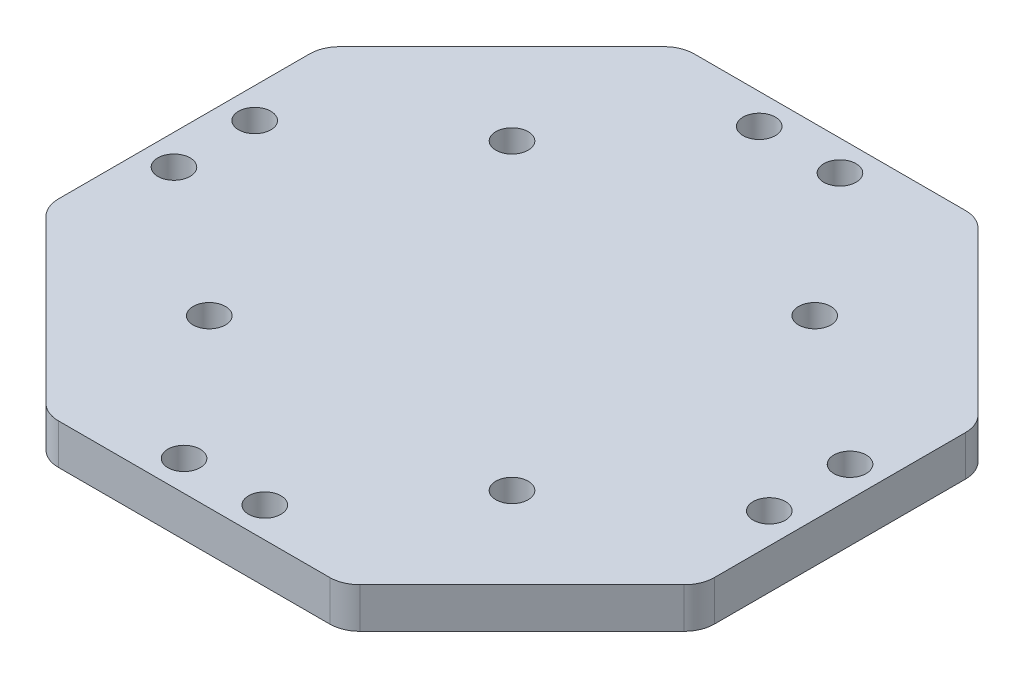
from build123d import *

# Parameters (mm, degrees)
SKETCH_1_W          = 65
SKETCH_1_H          = 63
EXTRUDE_1_DEPTH     = 4
SKETCH_2_R          = 1.6
CUT_EXTRUDE_1_DEPTH = 4
SKETCH_3_R          = 1.6
CUT_EXTRUDE_2_DEPTH = 4
FILLET_1_R          = 3
CUT_EXTRUDE_3_DEPTH = 10
FILLET_2_R          = 3


with BuildPart() as part:
    # 草图1 → 凸台-拉伸1 (new body)
    with BuildSketch(Plane(origin=(0, 0, 0), x_dir=(1, 0, 0), z_dir=(0, 1, 0))):
        Rectangle(SKETCH_1_W, SKETCH_1_H)
    extrude(amount=EXTRUDE_1_DEPTH)

    # 草图2 → 切除-拉伸1 (cut)
    with BuildSketch(Plane(origin=(0, 4, 0), x_dir=(1, 0, 0), z_dir=(0, 1, 0))):
        with Locations(Location((-15, -15, 0), (0, 0, 270))):
            Circle(SKETCH_2_R)
        with Locations(Location((-15, 15, 0), (0, 0, 90))):
            Circle(SKETCH_2_R)
        with Locations(Location((15, 15, 0), (0, 0, 270))):
            Circle(SKETCH_2_R)
        with Locations(Location((15, -15, 0), (0, 0, 90))):
            Circle(SKETCH_2_R)
    extrude(amount=-CUT_EXTRUDE_1_DEPTH, mode=Mode.SUBTRACT)

    # 草图3 → 切除-拉伸2 (cut)
    with BuildSketch(Plane(origin=(0, 4, 0), x_dir=(1, 0, 0), z_dir=(0, 1, 0))):
        with Locations(Location((-4, -28.5, 0), (0, 0, 270))):
            Circle(SKETCH_3_R)
        with Locations(Location((4, -28.5, 0), (0, 0, 90))):
            Circle(SKETCH_3_R)
        with Locations(Location((4, 28.5, 0), (0, 0, 270))):
            Circle(SKETCH_3_R)
        with Locations(Location((-4, 28.5, 0), (0, 0, 90))):
            Circle(SKETCH_3_R)
        with Locations(Location((-29.5, -4, 0), (0, 0, 270))):
            Circle(SKETCH_3_R)
        with Locations(Location((-29.5, 4, 0), (0, 0, 90))):
            Circle(SKETCH_3_R)
        with Locations(Location((29.5, 4, 0), (0, 0, 270))):
            Circle(SKETCH_3_R)
        with Locations(Location((29.5, -4, 0), (0, 0, 90))):
            Circle(SKETCH_3_R)
    extrude(amount=-CUT_EXTRUDE_2_DEPTH, mode=Mode.SUBTRACT)

    # 圆角1
    fillet_1_edges = [part.edges().sort_by_distance(p)[0] for p in [
        (32.5, 2, 31.5),
        (-32.5, 2, 31.5),
        (-32.5, 2, -31.5),
        (32.5, 2, -31.5),
    ]]
    fillet(fillet_1_edges, radius=FILLET_1_R)

    # 草图5 → 切除-拉伸3 (cut)
    with BuildSketch(Plane(origin=(0, 4, 0), x_dir=(1, 0, 0), z_dir=(0, 1, 0))):
        Polygon((-47.682171846, -46.682171846), (-9.681789184, -36.5), (-37.5, -8.681789184), align=None)
        Polygon((37.5, -8.681789184), (47.682171846, -46.682171846), (9.681789184, -36.5), align=None)
        Polygon((-37.5, 8.681789184), (-47.682171846, 46.682171846), (-9.681789184, 36.5), align=None)
        Polygon((37.5, 8.681789184), (47.682171846, 46.682171846), (9.681789184, 36.5), align=None)
    extrude(amount=-CUT_EXTRUDE_3_DEPTH, mode=Mode.SUBTRACT)

    # 圆角2
    fillet_2_edges = [part.edges().sort_by_distance(p)[0] for p in [
        (32.5, 2, 13.681789184),
        (14.681789184, 2, 31.5),
        (-14.681789184, 2, -31.5),
        (-32.5, 2, -13.681789184),
        (32.5, 2, -13.681789184),
        (14.681789184, 2, -31.5),
        (-32.5, 2, 13.681789184),
        (-14.681789184, 2, 31.5),
    ]]
    fillet(fillet_2_edges, radius=FILLET_2_R)


solid = part.part
